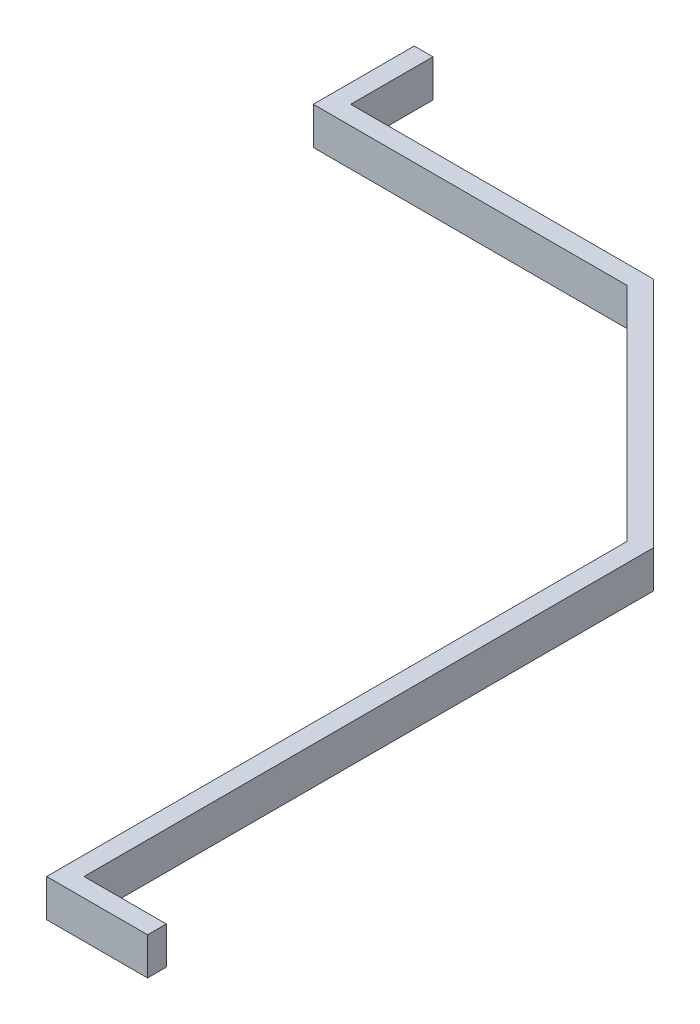
from build123d import *

# Parameters (mm, degrees)
BOSS_EXTRUDE1_DEPTH = 50.8


with BuildPart() as part:
    # Sketch1 → Boss-Extrude1 (new body)
    with BuildSketch(Plane(origin=(0, 0, 0), x_dir=(1, 0, 0), z_dir=(0, 1, 0))):
        Polygon((0, 0), (0, 772.707951031), (-315.98190963, 1088.689860661), (-726.739860661, 1088.689860661), (-726.739860661, 1200.289860661), (-752.139860661, 1200.289860661), (-752.139860661, 1063.289860661), (-326.502934114, 1063.289860661), (-25.4, 762.186926547), (-25.4, -25.4), (111.6, -25.4), (111.6, 0), align=None)
    extrude(amount=BOSS_EXTRUDE1_DEPTH)


solid = part.part
